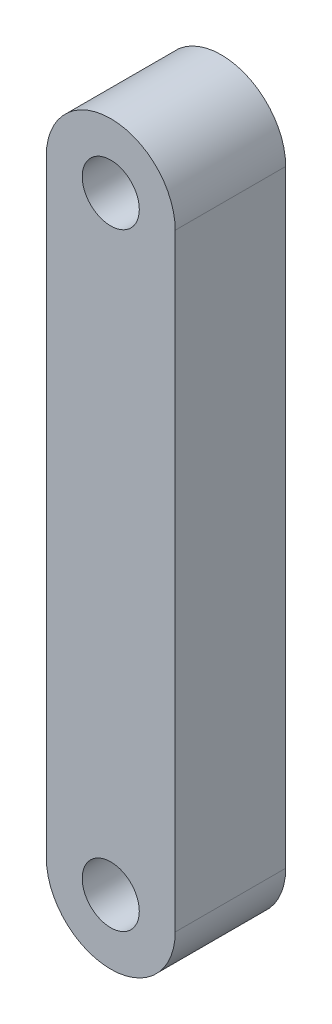
from build123d import *

# Parameters (mm, degrees)
SZKIC1_R                    = 1.55
DODANIE_WYCI_GNI_CIE1_DEPTH = 6


with BuildPart() as part:
    # Szkic1 → Dodanie-wyciągnięcie1 (new body)
    with BuildSketch(Plane.XY):
        with BuildLine():
            Line((1144.949531633, -37.211141118), (1144.949531633, -4.211141118))
            ThreePointArc((1144.949531633, -4.211141118), (1141.449531633, -0.711141118), (1137.949531633, -4.211141118))
            Line((1137.949531633, -4.211141118), (1137.949531633, -37.211141118))
            ThreePointArc((1137.949531633, -37.211141118), (1141.449531633, -40.711141118), (1144.949531633, -37.211141118))
        make_face()
        with Locations((1141.449531633, -4.211141118)):
            Circle(SZKIC1_R, mode=Mode.SUBTRACT)
        with Locations((1141.449531633, -37.211141118)):
            Circle(SZKIC1_R, mode=Mode.SUBTRACT)
    extrude(amount=DODANIE_WYCI_GNI_CIE1_DEPTH)


solid = part.part
